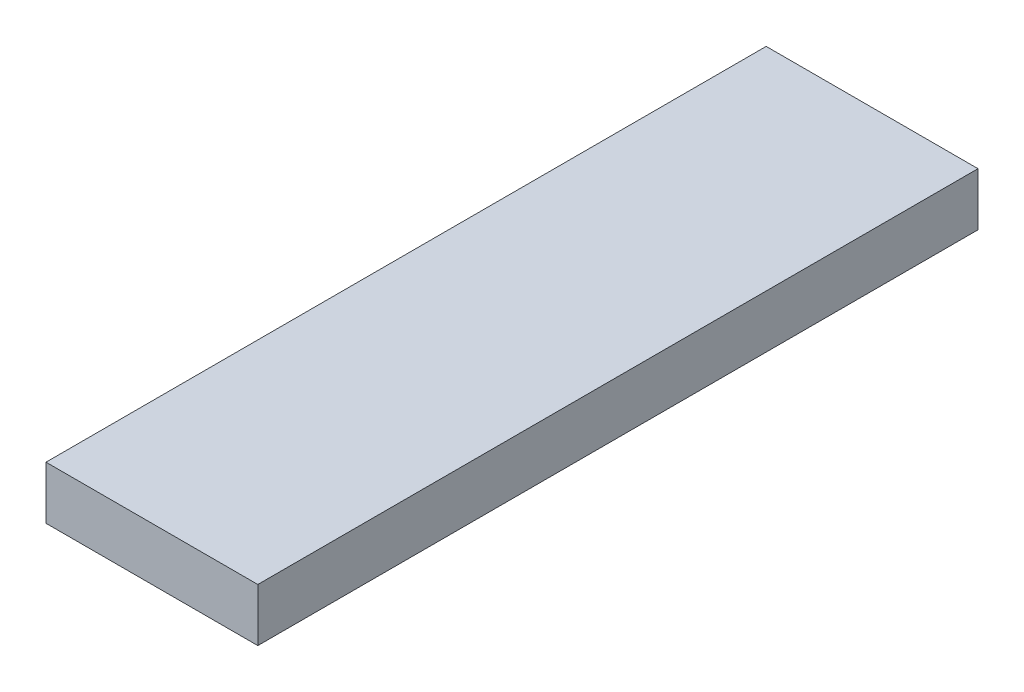
from build123d import *

# Parameters (mm, degrees)
SKETCH1_W           = 12.7
SKETCH1_H           = 43.18
BOSS_EXTRUDE1_DEPTH = 3.175


with BuildPart() as part:
    # Sketch1 → Boss-Extrude1 (new body)
    with BuildSketch(Plane(origin=(0, 0, 0), x_dir=(1, 0, 0), z_dir=(0, 1, 0))):
        with Locations((0.234061433, -2.836911263)):
            Rectangle(SKETCH1_W, SKETCH1_H)
    extrude(amount=BOSS_EXTRUDE1_DEPTH)


solid = part.part
